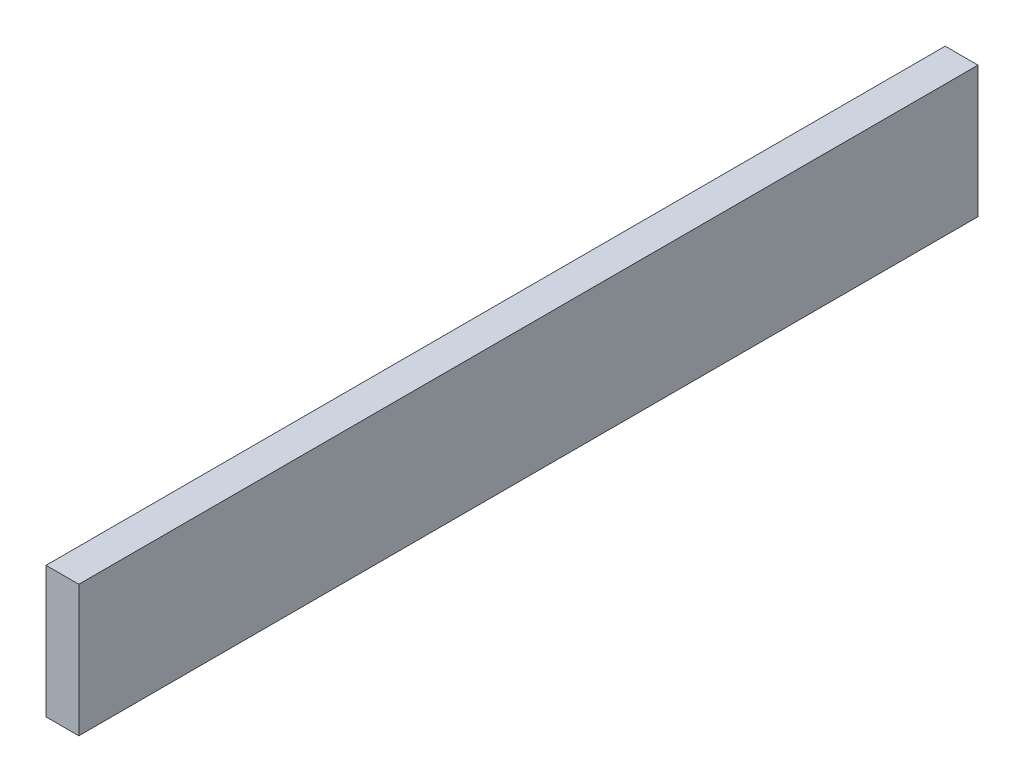
from build123d import *

# Parameters (mm, degrees)
SKETCH1_W           = 6.35
SKETCH1_H           = 25.4
BOSS_EXTRUDE1_DEPTH = 173.99


with BuildPart() as part:
    # Sketch1 → Boss-Extrude1 (new body)
    with BuildSketch(Plane.XY):
        with Locations((3.175, 12.7)):
            Rectangle(SKETCH1_W, SKETCH1_H)
    extrude(amount=BOSS_EXTRUDE1_DEPTH)


solid = part.part
